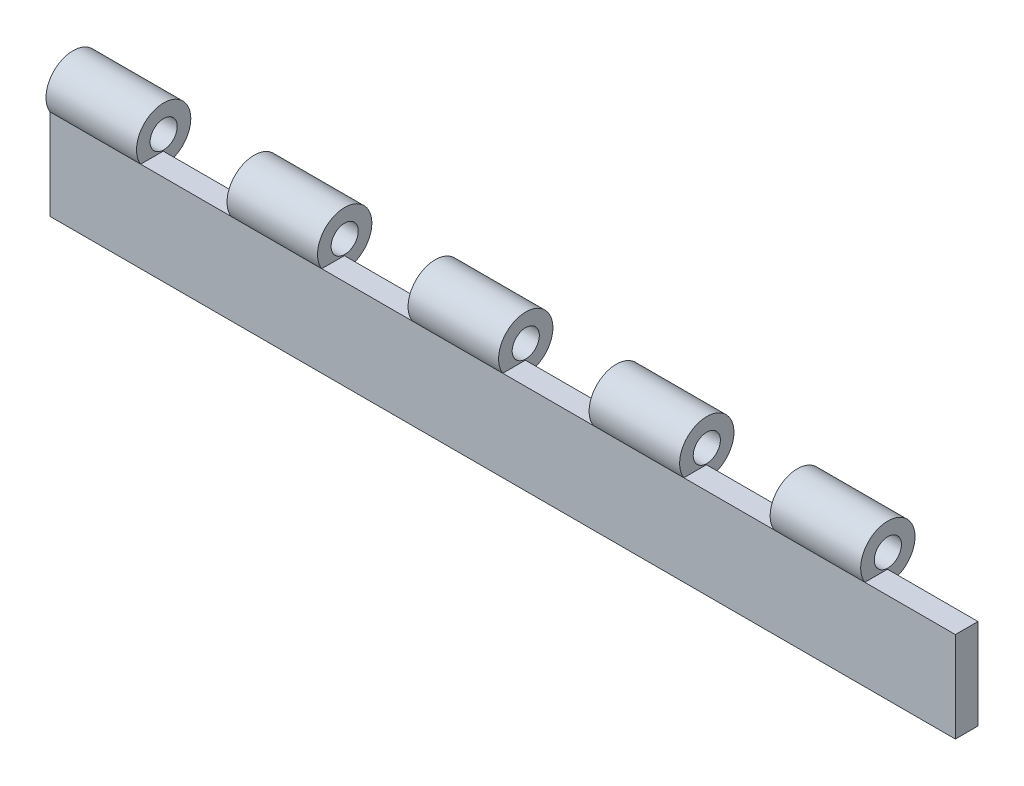
from build123d import *

# Parameters (mm, degrees)
SKETCH1_W           = 254
SKETCH1_H           = 25.4
BOSS_EXTRUDE1_DEPTH = 3.175
SKETCH2_R           = 7.62
SKETCH2_R_2         = 3.81
BOSS_EXTRUDE2_DEPTH = 25.4
LPATTERN1_COUNT     = 5
LPATTERN1_PITCH     = 50.8
SCALE1_SCALE        = 0.9


with BuildPart() as part:
    # Sketch1 → Boss-Extrude1 (new, symmetric)
    with BuildSketch(Plane.XY):
        with Locations((127, 12.7)):
            Rectangle(SKETCH1_W, SKETCH1_H)
    extrude(amount=BOSS_EXTRUDE1_DEPTH, both=True)

    # Sketch2 → Boss-Extrude2 (add)
    with BuildSketch(Plane.ZY):
        with Locations((-3.277326256, 29.453626264)):
            Circle(SKETCH2_R)
        with Locations(Location((-3.277326256, 29.453626264, 0), (0, 0, 270))):
            Circle(SKETCH2_R_2, mode=Mode.SUBTRACT)
    boss_extrude2 = extrude(amount=-BOSS_EXTRUDE2_DEPTH)

    # LPattern1: Boss-Extrude2 ×5
    with Locations(*[(i * LPATTERN1_PITCH, 0, 0) for i in range(1, LPATTERN1_COUNT)]):
        add(boss_extrude2)


with BuildPart() as part_1:
    # Scale1: scaled about (123.537042947, 17.465364595, -0.985815247)
    add(part.part.scale(SCALE1_SCALE).moved(Location((12.353704295, 1.746536459, -0.098581525))))


solid = part_1.part
